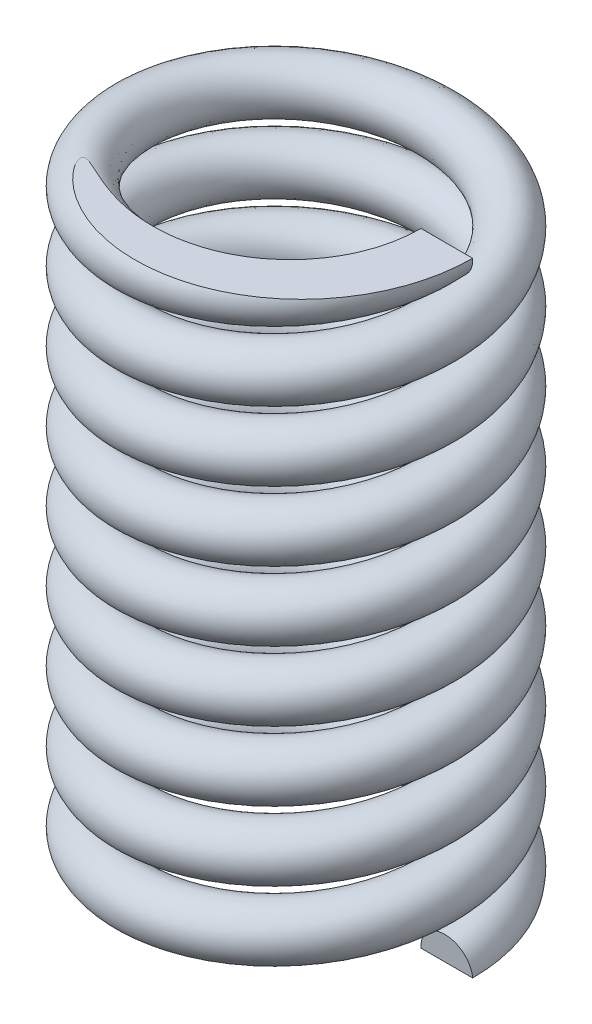
from build123d import *

# Parameters (mm, degrees)
SWEEP1_PITCH            = 8.72356811
SWEEP1_HEIGHT           = 78.512112994
SWEEP1_RADIUS           = 19
SWEEP1_START_ANGLE      = 90
SKETCH3_R               = 3.25
CUT_EXTRUDE1_DEPTH      = 145.341347098
CUT_EXTRUDE1_DEPTH_BACK = 145.341347098
SKETCH4_W               = 55
SKETCH4_H               = 15


with BuildPart() as part:
    # Sweep1: sweep along a helix
    with BuildLine() as sweep1_path:
        add(Helix(SWEEP1_PITCH, SWEEP1_HEIGHT, SWEEP1_RADIUS, center=(0, 59.11632414, 0), direction=(0, 1, 0), mode=Mode.PRIVATE).rotate(Axis((0, 59.11632414, 0), (0, 1, 0)), SWEEP1_START_ANGLE))
    # Sketch3 → Sweep1 (sweep)
    with BuildSketch(Plane(origin=(19, 59.11632414, 0), x_dir=(-1, 0, 0), z_dir=(0, 0.07287931105900848, -0.9973407672503738))):
        Circle(SKETCH3_R)
    sweep(path=sweep1_path.line, is_frenet=True)

    # Sketch4 → Cut-Extrude1 (cut, two sides: drawn at the far end of the back side and taken through both)
    with BuildSketch(Plane.XY.offset(-CUT_EXTRUDE1_DEPTH_BACK)):
        with Locations((0, 145.128437133)):
            Rectangle(SKETCH4_W, SKETCH4_H)
        with Locations((0, 51.61632414)):
            Rectangle(SKETCH4_W, SKETCH4_H)
    extrude(amount=CUT_EXTRUDE1_DEPTH + CUT_EXTRUDE1_DEPTH_BACK, mode=Mode.SUBTRACT)


solid = part.part
